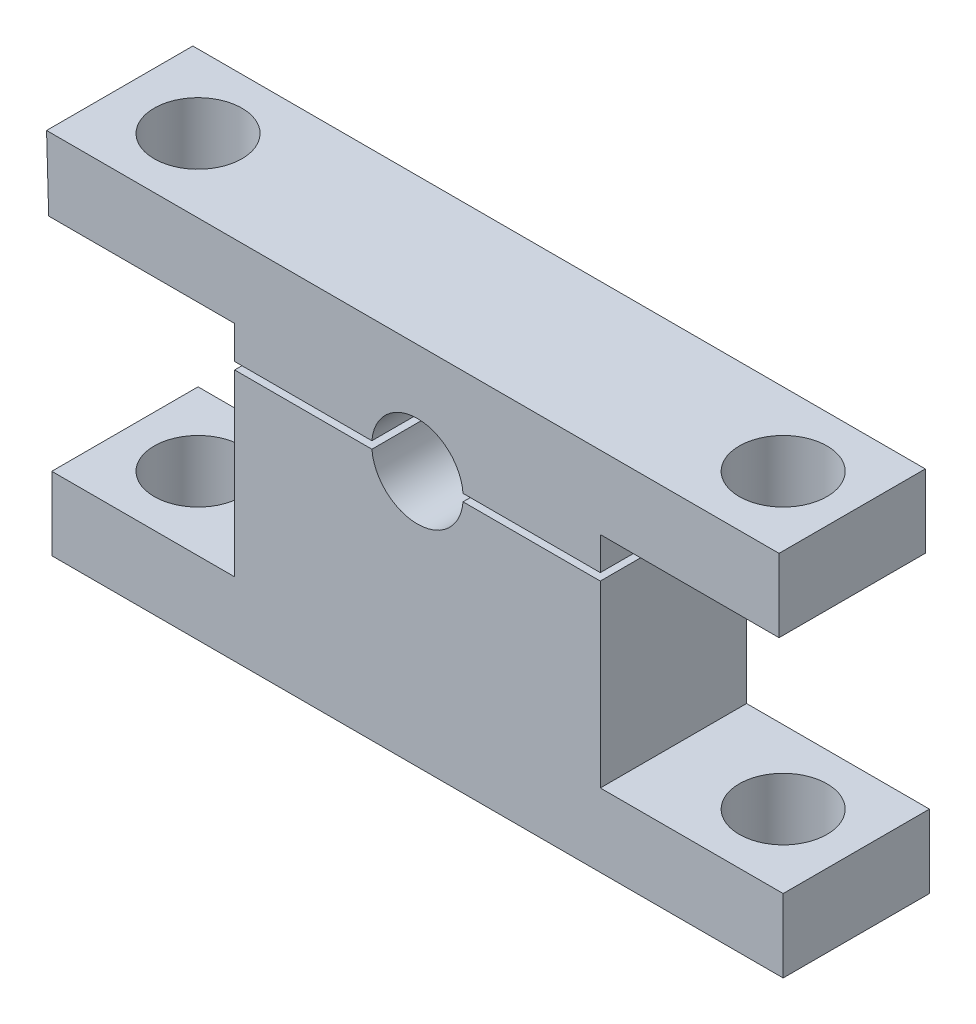
from build123d import *

# Parameters (mm, degrees)
BOSS_EXTRUDE1_DEPTH     = 5.08
BOSS_EXTRUDE1_2_DEPTH   = 5.08
CUT_EXTRUDE1_DEPTH      = 24.986
CUT_EXTRUDE1_DEPTH_BACK = 19.788527723
SKETCH4_R               = 1.524
CUT_EXTRUDE3_START      = -2.54
SKETCH8_R               = 1.524
CUT_EXTRUDE3_DEPTH      = 2.54


with BuildPart() as part:
    # Sketch2 → Boss-Extrude1 (new body)
    with BuildSketch(Plane.XY):
        with BuildLine():
            Line((-12.7, -6.35), (12.7, -6.35))
            Line((12.7, -6.35), (12.7, -3.81))
            Line((12.7, -3.81), (6.35, -3.81))
            Line((6.35, -3.81), (6.35, 0))
            Line((6.35, 0), (6.35, 2.413))
            Line((6.35, 2.413), (1.582411846, 2.413))
            ThreePointArc((1.582411846, 2.413), (0, 0.9525), (-1.582411846, 2.413))
            Line((-1.582411846, 2.413), (-6.35, 2.413))
            Line((-6.35, 2.413), (-6.35, 0))
            Line((-6.35, 0), (-6.35, -3.81))
            Line((-6.35, -3.81), (-12.7, -3.81))
            Line((-12.7, -3.81), (-12.7, -6.35))
        make_face()
    extrude(amount=BOSS_EXTRUDE1_DEPTH)

    # Sketch4 → Cut-Extrude1 (cut, two sides: drawn at the far end of the back side and taken through both)
    with BuildSketch(Plane(origin=(0, -6.35, 0), x_dir=(1, 0, 0), z_dir=(0, 1, 0)).offset(-CUT_EXTRUDE1_DEPTH_BACK)):
        with Locations(Location((-10.16, -2.54, 0), (0, 0, 270))):
            Circle(SKETCH4_R)
        with Locations(Location((10.16, -2.54, 0), (0, 0, 270))):
            Circle(SKETCH4_R)
    extrude(amount=CUT_EXTRUDE1_DEPTH + CUT_EXTRUDE1_DEPTH_BACK, mode=Mode.SUBTRACT)


with BuildPart() as body_2:
    # Sketch2 → Boss-Extrude1 2 (new body)
    with BuildSketch(Plane.XY):
        with BuildLine():
            Line((-12.806936218, 3.811499228), (-6.35, 3.811499228))
            Line((-6.35, 3.811499228), (-6.35, 2.667))
            Line((-6.35, 2.667), (-1.582411846, 2.667))
            ThreePointArc((-1.582411846, 2.667), (0, 4.1275), (1.582411846, 2.667))
            Line((1.582411846, 2.667), (6.35, 2.667))
            Line((6.35, 2.667), (6.35, 3.812680478))
            Line((6.35, 3.812680478), (12.557057806, 3.812680478))
            Line((12.557057806, 3.812680478), (12.557057806, 6.35))
            Line((12.557057806, 6.35), (-12.88069773, 6.35))
            Line((-12.88069773, 6.35), (-12.806936218, 3.811499228))
        make_face()
    extrude(amount=BOSS_EXTRUDE1_2_DEPTH)

    # Sketch8 → Cut-Extrude3 (cut)
    with BuildSketch(Plane(origin=(0, 6.35, 0), x_dir=(1, 0, 0), z_dir=(0, 1, 0)).offset(CUT_EXTRUDE3_START)):
        with Locations(Location((10.16, -2.54, 0), (0, 0, 270))):
            Circle(SKETCH8_R)
        with Locations(Location((-10.16, -2.54, 0), (0, 0, 270))):
            Circle(SKETCH8_R)
    extrude(amount=CUT_EXTRUDE3_DEPTH, mode=Mode.SUBTRACT)


solid = Compound([part.part, body_2.part])
